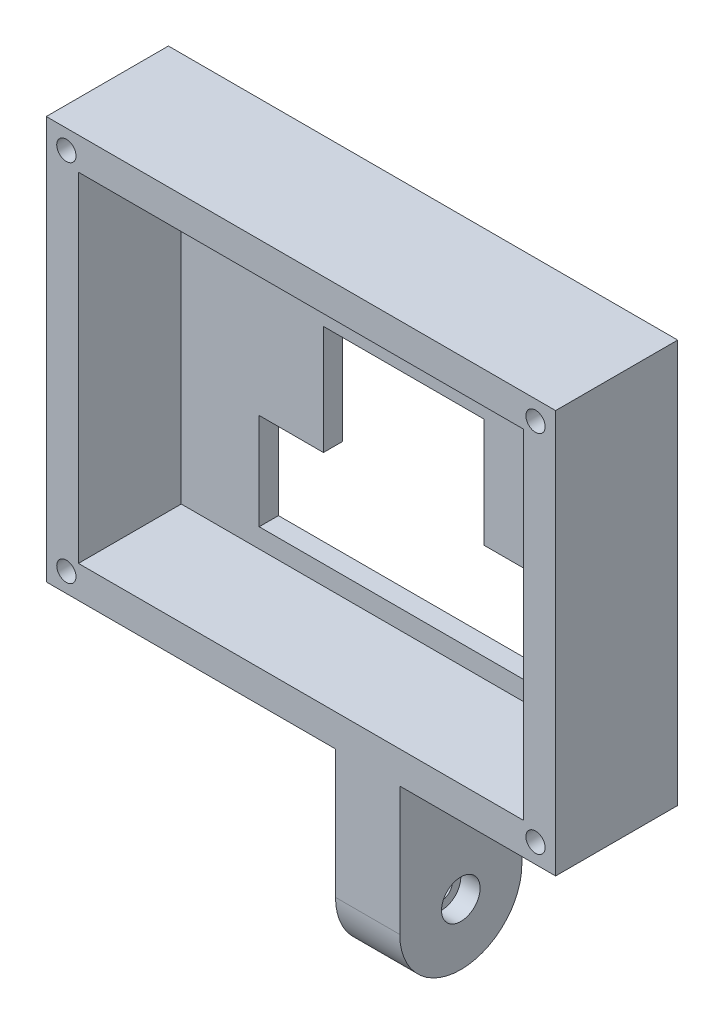
from build123d import *

# Parameters (mm, degrees)
SKETCH_1_W               = 79.25
SKETCH_1_H               = 62.72
EXTRUDE_1_DEPTH          = 19
SKETCH_2_W               = 69.25
SKETCH_2_H               = 52.72
CUT_EXTRUDE_1_DEPTH      = 16
CUT_EXTRUDE_2_DEPTH      = 10
CUT_EXTRUDE_3_DEPTH      = 77.582889897
CUT_EXTRUDE_3_DEPTH_BACK = 77.582889897
SKETCH_4_R               = 1.5
EXTRUDE_START            = -55
SKETCH_5_R               = 1.7
EXTRUDE_2_DEPTH          = 10
SKETCH_6_R               = 3
CUT_EXTRUDE_4_DEPTH      = 3


with BuildPart() as part:
    # 草图1 → 凸台-拉伸1 (new body)
    with BuildSketch(Plane.XY):
        with Locations((0, 31.36)):
            Rectangle(SKETCH_1_W, SKETCH_1_H)
    extrude(amount=EXTRUDE_1_DEPTH)

    # 草图2 → 切除-拉伸1 (cut)
    with BuildSketch(Plane.XY.offset(19)):
        with Locations((0, 31.36)):
            Rectangle(SKETCH_2_W, SKETCH_2_H)
    extrude(amount=-CUT_EXTRUDE_1_DEPTH, mode=Mode.SUBTRACT)

    # 草图3 → 切除-拉伸2 (cut)
    with BuildSketch(Plane(origin=(0, 0, 0), x_dir=(-1, 0, 0), z_dir=(0, 0, -1))):
        Polygon((12.5, 40), (-12.5, 40), (-12.5, 23), (-22.5, 23), (-22.5, 8), (22.5, 8), (22.5, 23), (12.5, 23), align=None)
    extrude(amount=-CUT_EXTRUDE_2_DEPTH, mode=Mode.SUBTRACT)

    # 草图4 → 切除-拉伸3 (cut, two sides: drawn at the far end of the back side and taken through both)
    with BuildSketch(Plane(origin=(0, 0, 0), x_dir=(-1, 0, 0), z_dir=(0, 0, -1)).offset(-CUT_EXTRUDE_3_DEPTH_BACK)):
        with Locations((-36.5, 59.72)):
            Circle(SKETCH_4_R)
        with Locations(Location((36.5, 59.72, 0), (0, 0, 180))):
            Circle(SKETCH_4_R)
        with Locations(Location((-36.5, 3, 0), (0, 0, 180))):
            Circle(SKETCH_4_R)
        with Locations((36.5, 3)):
            Circle(SKETCH_4_R)
    extrude(amount=CUT_EXTRUDE_3_DEPTH + CUT_EXTRUDE_3_DEPTH_BACK, mode=Mode.SUBTRACT)

    # 草图5 → 凸台-拉伸2 (add)
    with BuildSketch(Plane.ZY.offset(39.625).offset(EXTRUDE_START)):
        with BuildLine():
            Line((0, 0), (0, -20))
            ThreePointArc((0, -20), (9.5, -29.5), (19, -20))
            Line((19, -20), (19, 0))
            Line((19, 0), (0, 0))
        make_face()
        with Locations(Location((9.5, -20, 0), (0, 0, 270))):
            Circle(SKETCH_5_R, mode=Mode.SUBTRACT)
    extrude(amount=EXTRUDE_2_DEPTH)

    # 草图6 → 切除-拉伸4 (cut)
    with BuildSketch(Plane(origin=(15.375, 0, 0), x_dir=(0, 0, -1), z_dir=(1, 0, 0))):
        with Locations(Location((-9.5, -20, 0), (0, 0, 90))):
            Circle(SKETCH_6_R)
    extrude(amount=-CUT_EXTRUDE_4_DEPTH, mode=Mode.SUBTRACT)


solid = part.part
